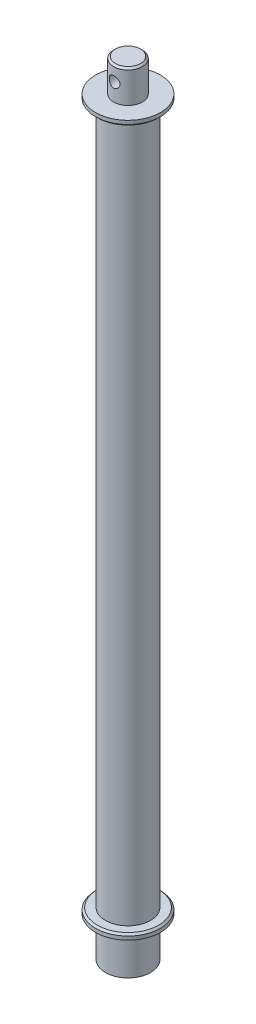
from build123d import *

# Parameters (mm, degrees)
SKETCH_1_R               = 7.95
EXTRUDE_1_DEPTH          = 18
CUT_EXTRUDE_2_DEPTH      = 22.22274723
CUT_EXTRUDE_2_DEPTH_BACK = 22.22274723
SKETCH_9_R               = 3
CHAMFER_2_SIZE           = 1
SKETCH_4_R               = 18
EXTRUDE_2_DEPTH          = 3
CHAMFER_1_SIZE           = 1
SKETCH_5_R               = 12.5
EXTRUDE_3_DEPTH          = 387.21
SKETCH_11_R              = 18
EXTRUDE_4_DEPTH          = 3
CHAMFER_3_SIZE           = 1
SKETCH_12_R              = 12.5
EXTRUDE_5_DEPTH          = 22


with BuildPart() as part:
    # 草图1 → 凸台-拉伸1 (new body)
    with BuildSketch(Plane(origin=(0, 0, 0), x_dir=(1, 0, 0), z_dir=(0, 1, 0))):
        with Locations(Location((0, 0, 0), (0, 0, 270))):
            Circle(SKETCH_1_R)
    extrude(amount=EXTRUDE_1_DEPTH)

    # 草图9 → 切除-拉伸2 (cut, two sides: drawn at the far end of the back side and taken through both)
    with BuildSketch(Plane.XY.offset(-CUT_EXTRUDE_2_DEPTH_BACK)):
        with Locations(Location((0, 9.7, 0), (0, 0, 89.999999999))):
            Circle(SKETCH_9_R)
    extrude(amount=CUT_EXTRUDE_2_DEPTH + CUT_EXTRUDE_2_DEPTH_BACK, mode=Mode.SUBTRACT)

    # 倒角2
    chamfer_2_edges = [part.edges().sort_by_distance(p)[0] for p in [
        (0, 18, -7.95),
    ]]
    chamfer(chamfer_2_edges, length=CHAMFER_2_SIZE)

    # 草图4 → 凸台-拉伸2 (add)
    with BuildSketch(Plane(origin=(0, 0, 0), x_dir=(1, 0, 0), z_dir=(0, 1, 0))):
        with Locations(Location((0, 0, 0), (0, 0, 270))):
            Circle(SKETCH_4_R)
    extrude(amount=-EXTRUDE_2_DEPTH)

    # 倒角1
    chamfer_1_edges = [part.edges().sort_by_distance(p)[0] for p in [
        (0, -3, -18),
    ]]
    chamfer(chamfer_1_edges, length=CHAMFER_1_SIZE)

    # 草图5 → 凸台-拉伸3 (add)
    with BuildSketch(Plane(origin=(0, -3, 0), x_dir=(-1, 0, 0), z_dir=(0, -1, 0))):
        with Locations(Location((0, 0, 0), (0, 0, 270))):
            Circle(SKETCH_5_R)
    extrude(amount=EXTRUDE_3_DEPTH)

    # 草图11 → 凸台-拉伸4 (add)
    with BuildSketch(Plane(origin=(0, -390.21, 0), x_dir=(-1, 0, 0), z_dir=(0, -1, 0))):
        with Locations(Location((0, 0, 0), (0, 0, 270))):
            Circle(SKETCH_11_R)
    extrude(amount=EXTRUDE_4_DEPTH)

    # 倒角3
    chamfer_3_edges = [part.edges().sort_by_distance(p)[0] for p in [
        (0, -390.21, -18),
    ]]
    chamfer(chamfer_3_edges, length=CHAMFER_3_SIZE)

    # 草图12 → 凸台-拉伸5 (add)
    with BuildSketch(Plane(origin=(0, -393.21, 0), x_dir=(-1, 0, 0), z_dir=(0, -1, 0))):
        with Locations(Location((0, 0, 0), (0, 0, 270))):
            Circle(SKETCH_12_R)
        with BuildLine():
            ThreePointArc((1.320081673, 7.281303755), (1.178664492, 7.305528729), (1.036804222, 7.32700737))
            add(Edge.make_bspline(
                [(1.036804222, 7.32700737), (0.98134965, 7.270157618), (0.925664274, 7.213171767), (0.822185541, 7.094937546), (0.774343886, 7.0337151), (0.63529092, 6.847559045), (0.548900941, 6.720025238), (0.477457544, 6.587144437)],
                knots=[0, 0, 0, 0, 0.25, 0.25, 0.5, 0.5, 1, 1, 1, 1], degree=3))
            add(Edge.make_bspline(
                [(0.477457544, 6.587144437), (0.46567048, 6.560002351), (0.446966493, 6.534634967), (0.392581446, 6.494187019), (0.35492303, 6.479375674), (0.274403836, 6.478342584), (0.234194599, 6.492926686), (0.17747799, 6.534562396), (0.158353176, 6.560913911), (0.146609232, 6.588640193)],
                knots=[0, 0, 0, 0, 0.25, 0.25, 0.5, 0.5, 0.75, 0.75, 1, 1, 1, 1], degree=3))
            add(Edge.make_bspline(
                [(0.146609232, 6.588640193), (0.08740641, 6.729534896), (0.022470705, 6.869008307), (-0.095794129, 7.071358543), (-0.138881023, 7.137641916), (-0.232486034, 7.266772188), (-0.282985736, 7.329709483), (-0.333258043, 7.392492075)],
                knots=[0, 0, 0, 0, 0.5, 0.5, 0.75, 0.75, 1, 1, 1, 1], degree=3))
            ThreePointArc((-0.333258043, 7.392492075), (-0.476520163, 7.384641395), (-0.619603147, 7.374014642))
            add(Edge.make_bspline(
                [(-0.619603147, 7.374014642), (-0.661016757, 7.306295373), (-0.702626317, 7.238396062), (-0.777131854, 7.100013493), (-0.81002747, 7.029653932), (-0.904545175, 6.817549796), (-0.96175064, 6.674495088), (-1.00180826, 6.529141787)],
                knots=[0, 0, 0, 0, 0.25, 0.25, 0.5, 0.5, 1, 1, 1, 1], degree=3))
            add(Edge.make_bspline(
                [(-1.00180826, 6.529141787), (-1.007260291, 6.500056407), (-1.019851277, 6.471161347), (-1.063877396, 6.419622784), (-1.097300476, 6.396802915), (-1.175575057, 6.377883569), (-1.218016451, 6.383157985), (-1.2825686, 6.411128867), (-1.307075953, 6.432562593), (-1.324694352, 6.456979366)],
                knots=[0, 0, 0, 0, 0.25, 0.25, 0.5, 0.5, 0.75, 0.75, 1, 1, 1, 1], degree=3))
            add(Edge.make_bspline(
                [(-1.324694352, 6.456979366), (-1.413614576, 6.580958145), (-1.507332752, 6.702515875), (-1.667328954, 6.873226276), (-1.724044414, 6.928139193), (-1.843879739, 7.033004611), (-1.907009883, 7.083047863), (-1.969886809, 7.132989974)],
                knots=[0, 0, 0, 0, 0.5, 0.5, 0.75, 0.75, 1, 1, 1, 1], degree=3))
            ThreePointArc((-1.969886809, 7.132989974), (-2.107810108, 7.093457306), (-2.244941028, 7.051258028))
            add(Edge.make_bspline(
                [(-2.244941028, 7.051258028), (-2.270240635, 6.97611209), (-2.29569085, 6.900747155), (-2.33740091, 6.749436272), (-2.353691734, 6.673613582), (-2.399065608, 6.44603228), (-2.42437654, 6.293898001), (-2.431078979, 6.143425776)],
                knots=[0, 0, 0, 0, 0.25, 0.25, 0.5, 0.5, 1, 1, 1, 1], degree=3))
            add(Edge.make_bspline(
                [(-2.431078979, 6.143425776), (-2.429922181, 6.113855694), (-2.43576799, 6.082881939), (-2.467225285, 6.0228357), (-2.494736028, 5.993149765), (-2.566842091, 5.957290187), (-2.609389834, 5.952991684), (-2.678542059, 5.965898104), (-2.70720286, 5.981340256), (-2.729811993, 6.001223703)],
                knots=[0, 0, 0, 0, 0.25, 0.25, 0.5, 0.5, 0.75, 0.75, 1, 1, 1, 1], degree=3))
            add(Edge.make_bspline(
                [(-2.729811993, 6.001223703), (-2.843877093, 6.102118361), (-2.961914778, 6.199724831), (-3.155568154, 6.330271891), (-3.22298186, 6.371086663), (-3.36290588, 6.446499746), (-3.435454942, 6.481176753), (-3.507737225, 6.51580997)],
                knots=[0, 0, 0, 0, 0.5, 0.5, 0.75, 0.75, 1, 1, 1, 1], degree=3))
            ThreePointArc((-3.507737225, 6.51580997), (-3.633405652, 6.446577648), (-3.757708191, 6.374921894))
            add(Edge.make_bspline(
                [(-3.757708191, 6.374921894), (-3.765661336, 6.296145746), (-3.773711675, 6.217123105), (-3.780628656, 6.060577536), (-3.779555087, 5.98316972), (-3.773567955, 5.751425564), (-3.76559783, 5.597330834), (-3.73868501, 5.449337815)],
                knots=[0, 0, 0, 0, 0.25, 0.25, 0.5, 0.5, 1, 1, 1, 1], degree=3))
            add(Edge.make_bspline(
                [(-3.73868501, 5.449337815), (-3.730977124, 5.420766049), (-3.729784019, 5.389267097), (-3.747092838, 5.323723878), (-3.767310283, 5.288659423), (-3.829632003, 5.237655307), (-3.870154864, 5.223999521), (-3.940441779, 5.221196026), (-3.971819075, 5.229873104), (-3.998285225, 5.244226695)],
                knots=[0, 0, 0, 0, 0.25, 0.25, 0.5, 0.5, 0.75, 0.75, 1, 1, 1, 1], degree=3))
            add(Edge.make_bspline(
                [(-3.998285225, 5.244226695), (-4.131679461, 5.317066829), (-4.268286418, 5.385729002), (-4.485811664, 5.469600321), (-4.560473941, 5.49433348), (-4.71337102, 5.536635681), (-4.791666926, 5.5542605), (-4.869695049, 5.571900047)],
                knots=[0, 0, 0, 0, 0.5, 0.5, 0.75, 0.75, 1, 1, 1, 1], degree=3))
            ThreePointArc((-4.869695049, 5.571900047), (-4.976807066, 5.476439668), (-5.082048175, 5.378920556))
            add(Edge.make_bspline(
                [(-5.082048175, 5.378920556), (-5.072307153, 5.300480381), (-5.062604808, 5.221779379), (-5.034518789, 5.067912661), (-5.016219275, 4.992847823), (-4.959223266, 4.768468173), (-4.918131698, 4.619753183), (-4.859057526, 4.481682374)],
                knots=[0, 0, 0, 0, 0.25, 0.25, 0.5, 0.5, 1, 1, 1, 1], degree=3))
            add(Edge.make_bspline(
                [(-4.859057526, 4.481682374), (-4.84518497, 4.455541927), (-4.837012485, 4.425097777), (-4.839303134, 4.35734495), (-4.85121199, 4.318660125), (-4.900623152, 4.255067306), (-4.937090851, 4.232738081), (-5.004990321, 4.214365565), (-5.037511241, 4.215842975), (-5.066507504, 4.223947336)],
                knots=[0, 0, 0, 0, 0.25, 0.25, 0.5, 0.5, 0.75, 0.75, 1, 1, 1, 1], degree=3))
            add(Edge.make_bspline(
                [(-5.066507504, 4.223947336), (-5.212479986, 4.265197318), (-5.360842681, 4.301259016), (-5.591236124, 4.334292187), (-5.669365778, 4.341792837), (-5.82752242, 4.349018187), (-5.907622431, 4.348769055), (-5.987466029, 4.348591789)],
                knots=[0, 0, 0, 0, 0.5, 0.5, 0.75, 0.75, 1, 1, 1, 1], degree=3))
            ThreePointArc((-5.987466029, 4.348591789), (-6.070650592, 4.231690135), (-6.151553043, 4.113197681))
            add(Edge.make_bspline(
                [(-6.151553043, 4.113197681), (-6.124665565, 4.039025234), (-6.097756483, 3.964591683), (-6.036232894, 3.821126102), (-6.001721667, 3.752176471), (-5.89662458, 3.54632475), (-5.824172681, 3.410224987), (-5.736016371, 3.288981736)],
                knots=[0, 0, 0, 0, 0.25, 0.25, 0.5, 0.5, 1, 1, 1, 1], degree=3))
            add(Edge.make_bspline(
                [(-5.736016371, 3.288981736), (-5.716674869, 3.266583661), (-5.701932862, 3.238721432), (-5.689089612, 3.172157886), (-5.692091568, 3.131793217), (-5.726112746, 3.058799878), (-5.756697383, 3.028915331), (-5.818806504, 2.995894044), (-5.850840964, 2.990097794), (-5.880913704, 2.99154669)],
                knots=[0, 0, 0, 0, 0.25, 0.25, 0.5, 0.5, 0.75, 0.75, 1, 1, 1, 1], degree=3))
            add(Edge.make_bspline(
                [(-5.880913704, 2.99154669), (-6.032125452, 2.999266228), (-6.184669857, 3.000659406), (-6.416269574, 2.981259188), (-6.493951949, 2.971250179), (-6.649452268, 2.943197824), (-6.727343, 2.925149799), (-6.805000462, 2.907226981)],
                knots=[0, 0, 0, 0, 0.5, 0.5, 0.75, 0.75, 1, 1, 1, 1], degree=3))
            ThreePointArc((-6.805000462, 2.907226981), (-6.860086348, 2.774745989), (-6.912593354, 2.641221899))
            add(Edge.make_bspline(
                [(-6.912593354, 2.641221899), (-6.86996668, 2.575015519), (-6.827259822, 2.508561801), (-6.735534222, 2.382638229), (-6.68663265, 2.323229472), (-6.538755144, 2.146143868), (-6.438293854, 2.029438921), (-6.325587168, 1.931042891)],
                knots=[0, 0, 0, 0, 0.25, 0.25, 0.5, 0.5, 1, 1, 1, 1], degree=3))
            add(Edge.make_bspline(
                [(-6.325587168, 1.931042891), (-6.301746827, 1.91351047), (-6.281174901, 1.889627675), (-6.253842013, 1.827592925), (-6.247786067, 1.787573767), (-6.264709489, 1.708840724), (-6.287877015, 1.67289766), (-6.341082224, 1.626881406), (-6.371024468, 1.614101802), (-6.400666098, 1.608822474)],
                knots=[0, 0, 0, 0, 0.25, 0.25, 0.5, 0.5, 0.75, 0.75, 1, 1, 1, 1], degree=3))
            add(Edge.make_bspline(
                [(-6.400666098, 1.608822474), (-6.549559075, 1.582743795), (-6.698324928, 1.549172857), (-6.919406346, 1.478394293), (-6.992789957, 1.451467308), (-7.137909138, 1.389684274), (-7.209706129, 1.354796727), (-7.281303755, 1.320081673)],
                knots=[0, 0, 0, 0, 0.5, 0.5, 0.75, 0.75, 1, 1, 1, 1], degree=3))
            ThreePointArc((-7.281303755, 1.320081673), (-7.305528729, 1.178664493), (-7.32700737, 1.036804223))
            add(Edge.make_bspline(
                [(-7.32700737, 1.036804223), (-7.270829339, 0.981845361), (-7.21451758, 0.926666067), (-7.097308167, 0.824494804), (-7.036536641, 0.777540611), (-6.853346185, 0.638018122), (-6.729723915, 0.546669005), (-6.598206373, 0.475958565)],
                knots=[0, 0, 0, 0, 0.25, 0.25, 0.5, 0.5, 1, 1, 1, 1], degree=3))
            add(Edge.make_bspline(
                [(-6.598206373, 0.475958565), (-6.571624678, 0.463639432), (-6.546877049, 0.444637459), (-6.507538993, 0.390166285), (-6.493277367, 0.35281192), (-6.492280063, 0.273518396), (-6.506240234, 0.233785027), (-6.546781435, 0.176863082), (-6.572509338, 0.157415149), (-6.59970213, 0.145110252)],
                knots=[0, 0, 0, 0, 0.25, 0.25, 0.5, 0.5, 0.75, 0.75, 1, 1, 1, 1], degree=3))
            add(Edge.make_bspline(
                [(-6.59970213, 0.145110252), (-6.738870057, 0.086632861), (-6.875941633, 0.019665553), (-7.075315702, -0.09884181), (-7.140797267, -0.141273025), (-7.268373925, -0.233592416), (-7.330511037, -0.283531059), (-7.392492075, -0.333258043)],
                knots=[0, 0, 0, 0, 0.5, 0.5, 0.75, 0.75, 1, 1, 1, 1], degree=3))
            ThreePointArc((-7.392492075, -0.333258043), (-7.384641395, -0.476520163), (-7.374014642, -0.619603147))
            add(Edge.make_bspline(
                [(-7.374014642, -0.619603147), (-7.307137234, -0.660609026), (-7.240080527, -0.701797019), (-7.103332751, -0.775228732), (-7.033771876, -0.807459702), (-6.824506903, -0.902506121), (-6.683886014, -0.96371013), (-6.540203723, -1.00330724)],
                knots=[0, 0, 0, 0, 0.25, 0.25, 0.5, 0.5, 1, 1, 1, 1], degree=3))
            add(Edge.make_bspline(
                [(-6.540203723, -1.00330724), (-6.511347255, -1.00910232), (-6.482739972, -1.021921218), (-6.431772235, -1.066116528), (-6.409274207, -1.099443431), (-6.390513761, -1.177071883), (-6.395515726, -1.219205986), (-6.422889996, -1.283735745), (-6.443966352, -1.308345255), (-6.468041302, -1.326193332)],
                knots=[0, 0, 0, 0, 0.25, 0.25, 0.5, 0.5, 0.75, 0.75, 1, 1, 1, 1], degree=3))
            add(Edge.make_bspline(
                [(-6.468041302, -1.326193332), (-6.590585732, -1.414084809), (-6.708551773, -1.511042288), (-6.876132514, -1.671225086), (-6.9305228, -1.727007263), (-7.034294678, -1.845195621), (-7.083694901, -1.907661656), (-7.132989974, -1.969886809)],
                knots=[0, 0, 0, 0, 0.5, 0.5, 0.75, 0.75, 1, 1, 1, 1], degree=3))
            ThreePointArc((-7.132989974, -1.969886809), (-7.093457306, -2.107810108), (-7.051258028, -2.244941028))
            add(Edge.make_bspline(
                [(-7.051258028, -2.244941028), (-6.977050627, -2.269992263), (-6.902628685, -2.295178253), (-6.753208404, -2.336331226), (-6.678338983, -2.352311874), (-6.453543439, -2.398199602), (-6.303121798, -2.425957395), (-6.154487712, -2.432577958)],
                knots=[0, 0, 0, 0, 0.25, 0.25, 0.5, 0.5, 1, 1, 1, 1], degree=3))
            add(Edge.make_bspline(
                [(-6.154487712, -2.432577958), (-6.124965795, -2.431542676), (-6.094067853, -2.437477983), (-6.034193537, -2.469017995), (-6.004615511, -2.49651281), (-5.968842443, -2.56841858), (-5.964471907, -2.610863097), (-5.977193326, -2.679979868), (-5.992521252, -2.70865298), (-6.012285639, -2.731310973)],
                knots=[0, 0, 0, 0, 0.25, 0.25, 0.5, 0.5, 0.75, 0.75, 1, 1, 1, 1], degree=3))
            add(Edge.make_bspline(
                [(-6.012285639, -2.731310973), (-6.112142188, -2.844202248), (-6.204549346, -2.966054877), (-6.331861183, -3.159767754), (-6.372526395, -3.226120105), (-6.4474172, -3.364273666), (-6.48163794, -3.436134768), (-6.51580997, -3.507737224)],
                knots=[0, 0, 0, 0, 0.5, 0.5, 0.75, 0.75, 1, 1, 1, 1], degree=3))
            ThreePointArc((-6.51580997, -3.507737224), (-6.446577648, -3.633405652), (-6.374921894, -3.757708191))
            add(Edge.make_bspline(
                [(-6.374921894, -3.757708191), (-6.297102394, -3.765598577), (-6.21904506, -3.773570126), (-6.064397237, -3.7805044), (-5.987928246, -3.779507791), (-5.758921713, -3.774016921), (-5.606565563, -3.76676453), (-5.460399751, -3.740183989)],
                knots=[0, 0, 0, 0, 0.25, 0.25, 0.5, 0.5, 1, 1, 1, 1], degree=3))
            add(Edge.make_bspline(
                [(-5.460399751, -3.740183989), (-5.431823439, -3.732418074), (-5.40030852, -3.731177545), (-5.334720481, -3.748415503), (-5.299616831, -3.768608497), (-5.248540205, -3.830981635), (-5.234880471, -3.871572018), (-5.232141539, -3.941927929), (-5.24087366, -3.973321938), (-5.255288632, -3.999784205)],
                knots=[0, 0, 0, 0, 0.25, 0.25, 0.5, 0.5, 0.75, 0.75, 1, 1, 1, 1], degree=3))
            add(Edge.make_bspline(
                [(-5.255288632, -3.999784205), (-5.327511438, -4.132047911), (-5.389270515, -4.272286497), (-5.469870449, -4.489707851), (-5.494845986, -4.563356811), (-5.537194431, -4.714621993), (-5.554541842, -4.792290433), (-5.571900047, -4.869695049)],
                knots=[0, 0, 0, 0, 0.5, 0.5, 0.75, 0.75, 1, 1, 1, 1], degree=3))
            ThreePointArc((-5.571900047, -4.869695049), (-5.476439668, -4.976807066), (-5.378920556, -5.082048175))
            add(Edge.make_bspline(
                [(-5.378920556, -5.082048175), (-5.301372786, -5.072419594), (-5.223576685, -5.062815367), (-5.071366047, -5.03526514), (-4.997058759, -5.017385834), (-4.775370132, -4.96086732), (-4.629176425, -4.918929555), (-4.49274431, -4.860556505)],
                knots=[0, 0, 0, 0, 0.25, 0.25, 0.5, 0.5, 1, 1, 1, 1], degree=3))
            add(Edge.make_bspline(
                [(-4.49274431, -4.860556505), (-4.46662118, -4.846540536), (-4.436157617, -4.838243813), (-4.368313369, -4.840349291), (-4.329535439, -4.852192893), (-4.265745411, -4.901715291), (-4.243394366, -4.938335211), (-4.225157199, -5.00641079), (-4.226757265, -5.038991519), (-4.235009272, -5.068006484)],
                knots=[0, 0, 0, 0, 0.25, 0.25, 0.5, 0.5, 0.75, 0.75, 1, 1, 1, 1], degree=3))
            add(Edge.make_bspline(
                [(-4.235009272, -5.068006484), (-4.276003088, -5.213071968), (-4.303709721, -5.364153748), (-4.333505381, -5.594282073), (-4.341580003, -5.671613239), (-4.349304529, -5.82851082), (-4.34891285, -5.908116317), (-4.348591789, -5.987466029)],
                knots=[0, 0, 0, 0, 0.5, 0.5, 0.75, 0.75, 1, 1, 1, 1], degree=3))
            ThreePointArc((-4.348591789, -5.987466029), (-4.231690135, -6.070650591), (-4.113197681, -6.151553043))
            add(Edge.make_bspline(
                [(-4.113197681, -6.151553043), (-4.039783559, -6.124908026), (-3.966123504, -6.098230328), (-3.823872387, -6.037603171), (-3.755367487, -6.003743254), (-3.552160679, -5.899099438), (-3.419978779, -5.824720505), (-3.300043672, -5.737515351)],
                knots=[0, 0, 0, 0, 0.25, 0.25, 0.5, 0.5, 1, 1, 1, 1], degree=3))
            add(Edge.make_bspline(
                [(-3.300043672, -5.737515351), (-3.277689094, -5.71805789), (-3.249837572, -5.703209451), (-3.183244497, -5.690191205), (-3.142821584, -5.693114769), (-3.069641507, -5.727178304), (-3.039697101, -5.757887731), (-3.006744703, -5.820180345), (-3.001039094, -5.852293203), (-3.002608626, -5.882412684)],
                knots=[0, 0, 0, 0, 0.25, 0.25, 0.5, 0.5, 0.75, 0.75, 1, 1, 1, 1], degree=3))
            add(Edge.make_bspline(
                [(-3.002608626, -5.882412684), (-3.010300366, -6.033077262), (-3.002439505, -6.186882044), (-2.979889363, -6.418088259), (-2.970658465, -6.495310423), (-2.943353058, -6.650084899), (-2.92522611, -6.727659924), (-2.907226981, -6.805000461)],
                knots=[0, 0, 0, 0, 0.5, 0.5, 0.75, 0.75, 1, 1, 1, 1], degree=3))
            ThreePointArc((-2.907226981, -6.805000461), (-2.774745989, -6.860086348), (-2.641221899, -6.912593354))
            add(Edge.make_bspline(
                [(-2.641221899, -6.912593354), (-2.575596368, -6.870268027), (-2.509739634, -6.827855556), (-2.384476826, -6.737158649), (-2.325130051, -6.688981028), (-2.150649193, -6.541521223), (-2.039600761, -6.438761828), (-1.942104828, -6.327086147)],
                knots=[0, 0, 0, 0, 0.25, 0.25, 0.5, 0.5, 1, 1, 1, 1], degree=3))
            add(Edge.make_bspline(
                [(-1.942104828, -6.327086147), (-1.924576727, -6.303251681), (-1.900704329, -6.282688722), (-1.83871447, -6.255358909), (-1.798727924, -6.249288233), (-1.720006887, -6.266163113), (-1.684018358, -6.289323559), (-1.637952408, -6.342555239), (-1.625165542, -6.37251332), (-1.61988441, -6.402165077)],
                knots=[0, 0, 0, 0, 0.25, 0.25, 0.5, 0.5, 0.75, 0.75, 1, 1, 1, 1], degree=3))
            add(Edge.make_bspline(
                [(-1.61988441, -6.402165077), (-1.593827277, -6.550935046), (-1.550844136, -6.699256637), (-1.477031366, -6.919865932), (-1.450918131, -6.993182562), (-1.389876038, -7.138164228), (-1.354889165, -7.20983428), (-1.320081673, -7.281303755)],
                knots=[0, 0, 0, 0, 0.5, 0.5, 0.75, 0.75, 1, 1, 1, 1], degree=3))
            ThreePointArc((-1.320081673, -7.281303755), (-1.178664493, -7.305528729), (-1.036804223, -7.32700737))
            add(Edge.make_bspline(
                [(-1.036804223, -7.32700737), (-0.982256494, -7.271122895), (-0.927503814, -7.21509805), (-0.825564244, -7.098956367), (-0.778328663, -7.038868824), (-0.641325169, -6.855985118), (-0.557241733, -6.730312994), (-0.487020501, -6.599705353)],
                knots=[0, 0, 0, 0, 0.25, 0.25, 0.5, 0.5, 1, 1, 1, 1], degree=3))
            add(Edge.make_bspline(
                [(-0.487020501, -6.599705353), (-0.475080621, -6.572732965), (-0.456296872, -6.547556103), (-0.40192786, -6.507444512), (-0.364389199, -6.492787345), (-0.28425499, -6.491722616), (-0.244139505, -6.506109386), (-0.187317374, -6.547434913), (-0.168084032, -6.573620987), (-0.156172188, -6.601201109)],
                knots=[0, 0, 0, 0, 0.25, 0.25, 0.5, 0.5, 0.75, 0.75, 1, 1, 1, 1], degree=3))
            add(Edge.make_bspline(
                [(-0.156172188, -6.601201109), (-0.097577071, -6.740649557), (-0.021812834, -6.875679488), (0.099610678, -7.074555161), (0.141367622, -7.140338523), (0.233204146, -7.268305364), (0.283342296, -7.330476435), (0.333258043, -7.392492075)],
                knots=[0, 0, 0, 0, 0.5, 0.5, 0.75, 0.75, 1, 1, 1, 1], degree=3))
            ThreePointArc((0.333258043, -7.392492075), (0.476520163, -7.384641395), (0.619603147, -7.374014642))
            add(Edge.make_bspline(
                [(0.619603147, -7.374014642), (0.660370815, -7.307311833), (0.70130806, -7.240430228), (0.775084866, -7.104238162), (0.807926708, -7.035045768), (0.90038307, -6.826095977), (0.952825914, -6.684740119), (0.992245304, -6.541702703)],
                knots=[0, 0, 0, 0, 0.25, 0.25, 0.5, 0.5, 1, 1, 1, 1], degree=3))
            add(Edge.make_bspline(
                [(0.992245304, -6.541702703), (0.997695812, -6.512625446), (1.010280614, -6.483744594), (1.054262508, -6.4322312), (1.087645051, -6.409412425), (1.165883134, -6.390449487), (1.208367326, -6.395694154), (1.272983501, -6.42366762), (1.297506148, -6.445114017), (1.315131395, -6.469540282)],
                knots=[0, 0, 0, 0, 0.25, 0.25, 0.5, 0.5, 0.75, 0.75, 1, 1, 1, 1], degree=3))
            add(Edge.make_bspline(
                [(1.315131395, -6.469540282), (1.403440776, -6.59266738), (1.507935266, -6.70743162), (1.670932876, -6.874532702), (1.726326574, -6.929495134), (1.844490868, -7.034020791), (1.907315988, -7.083555964), (1.969886809, -7.132989973)],
                knots=[0, 0, 0, 0, 0.5, 0.5, 0.75, 0.75, 1, 1, 1, 1], degree=3))
            ThreePointArc((1.969886809, -7.132989973), (2.107810108, -7.093457306), (2.244941028, -7.051258028))
            add(Edge.make_bspline(
                [(2.244941028, -7.051258028), (2.269850953, -6.97706445), (2.294886899, -6.902658683), (2.336639301, -6.753282033), (2.353386826, -6.67842288), (2.396638684, -6.453899015), (2.414906713, -6.304368104), (2.421516022, -6.155986692)],
                knots=[0, 0, 0, 0, 0.25, 0.25, 0.5, 0.5, 1, 1, 1, 1], degree=3))
            add(Edge.make_bspline(
                [(2.421516022, -6.155986692), (2.420359754, -6.126430154), (2.42606912, -6.095760585), (2.457666063, -6.035331432), (2.485143191, -6.005707166), (2.557440534, -5.969789244), (2.599530867, -5.965522609), (2.669026949, -5.978442784), (2.697639291, -5.993900633), (2.720249036, -6.013784618)],
                knots=[0, 0, 0, 0, 0.25, 0.25, 0.5, 0.5, 0.75, 0.75, 1, 1, 1, 1], degree=3))
            add(Edge.make_bspline(
                [(2.720249036, -6.013784618), (2.833958276, -6.114364687), (2.961706079, -6.203082965), (3.15816033, -6.32996766), (3.224498155, -6.371323427), (3.363196322, -6.447096548), (3.435603284, -6.481473532), (3.507737224, -6.51580997)],
                knots=[0, 0, 0, 0, 0.5, 0.5, 0.75, 0.75, 1, 1, 1, 1], degree=3))
            ThreePointArc((3.507737224, -6.51580997), (3.633405652, -6.446577647), (3.757708191, -6.374921894))
            add(Edge.make_bspline(
                [(3.757708191, -6.374921894), (3.765474723, -6.296929182), (3.773317866, -6.218701023), (3.780860722, -6.06352427), (3.780615646, -5.986675002), (3.772409596, -5.757927451), (3.755734546, -5.608240252), (3.729122053, -5.461898731)],
                knots=[0, 0, 0, 0, 0.25, 0.25, 0.5, 0.5, 1, 1, 1, 1], degree=3))
            add(Edge.make_bspline(
                [(3.729122053, -5.461898731), (3.721416487, -5.433335563), (3.720234329, -5.401798135), (3.737502503, -5.336368126), (3.757655938, -5.301330536), (3.819971289, -5.25026093), (3.860512934, -5.236574856), (3.930842792, -5.233747128), (3.962245647, -5.24242834), (3.988722268, -5.256787611)],
                knots=[0, 0, 0, 0, 0.25, 0.25, 0.5, 0.5, 0.75, 0.75, 1, 1, 1, 1], degree=3))
            add(Edge.make_bspline(
                [(3.988722268, -5.256787611), (4.122223543, -5.329686193), (4.266671225, -5.388035486), (4.486793268, -5.468284149), (4.560814599, -5.493894215), (4.713190584, -5.536993747), (4.791581441, -5.554435329), (4.869695049, -5.571900047)],
                knots=[0, 0, 0, 0, 0.5, 0.5, 0.75, 0.75, 1, 1, 1, 1], degree=3))
            ThreePointArc((4.869695049, -5.571900047), (4.976807066, -5.476439667), (5.082048175, -5.378920556))
            add(Edge.make_bspline(
                [(5.082048175, -5.378920556), (5.072230202, -5.301023499), (5.062435761, -5.222878746), (5.03525604, -5.069618206), (5.017944366, -4.99458565), (4.958615656, -4.773190077), (4.908104482, -4.631229012), (4.849494569, -4.494243289)],
                knots=[0, 0, 0, 0, 0.25, 0.25, 0.5, 0.5, 1, 1, 1, 1], degree=3))
            add(Edge.make_bspline(
                [(4.849494569, -4.494243289), (4.835616179, -4.468091848), (4.827427908, -4.437775543), (4.829768153, -4.369602472), (4.841358937, -4.331530263), (4.891563584, -4.267044762), (4.927578899, -4.245279052), (4.995435029, -4.226930556), (5.027959783, -4.228407104), (5.056944547, -4.236508251)],
                knots=[0, 0, 0, 0, 0.25, 0.25, 0.5, 0.5, 0.75, 0.75, 1, 1, 1, 1], degree=3))
            add(Edge.make_bspline(
                [(5.056944547, -4.236508251), (5.203602863, -4.277952183), (5.357503844, -4.303228143), (5.590327447, -4.332763287), (5.668353865, -4.341254566), (5.826814133, -4.349365459), (5.907273349, -4.34893547), (5.987466029, -4.348591789)],
                knots=[0, 0, 0, 0, 0.5, 0.5, 0.75, 0.75, 1, 1, 1, 1], degree=3))
            ThreePointArc((5.987466029, -4.348591789), (6.070650591, -4.231690135), (6.151553043, -4.113197681))
            add(Edge.make_bspline(
                [(6.151553043, -4.113197681), (6.124583133, -4.039304216), (6.09758228, -3.965162295), (6.036886712, -3.821494047), (6.003278493, -3.752033399), (5.895740814, -3.549204004), (5.814243398, -3.422282087), (5.726453415, -3.301542651)],
                knots=[0, 0, 0, 0, 0.25, 0.25, 0.5, 0.5, 1, 1, 1, 1], degree=3))
            add(Edge.make_bspline(
                [(5.726453415, -3.301542651), (5.70711549, -3.279148719), (5.692380095, -3.251285781), (5.679535313, -3.184812978), (5.682557947, -3.144179132), (5.716699765, -3.071151665), (5.746867425, -3.041630156), (5.809415924, -3.008351378), (5.841300643, -3.0026598), (5.871350747, -3.004107606)],
                knots=[0, 0, 0, 0, 0.25, 0.25, 0.5, 0.5, 0.75, 0.75, 1, 1, 1, 1], degree=3))
            add(Edge.make_bspline(
                [(5.871350747, -3.004107606), (6.023828681, -3.011891921), (6.179631422, -3.003072451), (6.413565407, -2.980358974), (6.491678393, -2.971209579), (6.648263692, -2.94376439), (6.726752761, -2.925423003), (6.805000461, -2.907226981)],
                knots=[0, 0, 0, 0, 0.5, 0.5, 0.75, 0.75, 1, 1, 1, 1], degree=3))
            ThreePointArc((6.805000461, -2.907226981), (6.860086348, -2.774745989), (6.912593354, -2.641221899))
            add(Edge.make_bspline(
                [(6.912593354, -2.641221899), (6.86976468, -2.575058863), (6.826851514, -2.508658174), (6.735532407, -2.381837093), (6.687221533, -2.321464741), (6.536822945, -2.147482722), (6.42870485, -2.041977096), (6.316024211, -1.943603807)],
                knots=[0, 0, 0, 0, 0.25, 0.25, 0.5, 0.5, 1, 1, 1, 1], degree=3))
            add(Edge.make_bspline(
                [(6.316024211, -1.943603807), (6.292202798, -1.926085306), (6.271651915, -1.902231085), (6.244322401, -1.840300294), (6.238219617, -1.80007818), (6.25517879, -1.721324441), (6.278134546, -1.685622461), (6.331648585, -1.639321858), (6.36147363, -1.626660559), (6.391103141, -1.621383389)],
                knots=[0, 0, 0, 0, 0.25, 0.25, 0.5, 0.5, 0.75, 0.75, 1, 1, 1, 1], degree=3))
            add(Edge.make_bspline(
                [(6.391103141, -1.621383389), (6.541729214, -1.595001158), (6.69194757, -1.552723515), (6.915357219, -1.478839564), (6.989595583, -1.452422514), (7.136382962, -1.390656815), (7.208944937, -1.355270783), (7.281303755, -1.320081673)],
                knots=[0, 0, 0, 0, 0.5, 0.5, 0.75, 0.75, 1, 1, 1, 1], degree=3))
            ThreePointArc((7.281303755, -1.320081673), (7.305528729, -1.178664493), (7.32700737, -1.036804222))
            add(Edge.make_bspline(
                [(7.32700737, -1.036804222), (7.270516282, -0.981524202), (7.21384699, -0.926100448), (7.096137231, -0.823440055), (7.035290397, -0.775846781), (6.912053503, -0.683229244), (6.849785584, -0.638082087), (6.721178434, -0.557651364), (6.655248604, -0.522126639), (6.588643417, -0.488519481)],
                knots=[0, 0, 0, 0, 0.25, 0.25, 0.5, 0.5, 0.75, 0.75, 1, 1, 1, 1], degree=3))
            add(Edge.make_bspline(
                [(6.588643417, -0.488519481), (6.561514446, -0.476738112), (6.536164364, -0.45804855), (6.49573421, -0.403728944), (6.48088063, -0.36632396), (6.479835772, -0.285141211), (6.494187284, -0.245600895), (6.536230184, -0.188290374), (6.56242334, -0.169410687), (6.590139173, -0.157671168)],
                knots=[0, 0, 0, 0, 0.25, 0.25, 0.5, 0.5, 0.75, 0.75, 1, 1, 1, 1], degree=3))
            add(Edge.make_bspline(
                [(6.590139173, -0.157671168), (6.731618184, -0.099892576), (6.869008547, -0.025561734), (7.070502771, 0.096970963), (7.137119201, 0.13919962), (7.266757098, 0.231958076), (7.329709777, 0.282708602), (7.392492075, 0.333258043)],
                knots=[0, 0, 0, 0, 0.5, 0.5, 0.75, 0.75, 1, 1, 1, 1], degree=3))
            ThreePointArc((7.392492075, 0.333258043), (7.384641395, 0.476520163), (7.374014642, 0.619603147))
            add(Edge.make_bspline(
                [(7.374014642, 0.619603147), (7.306468657, 0.660973003), (7.238741537, 0.702534707), (7.100647139, 0.776668242), (7.030396293, 0.809267586), (6.818939408, 0.904598163), (6.676384081, 0.963426857), (6.530640767, 0.990746324)],
                knots=[0, 0, 0, 0, 0.25, 0.25, 0.5, 0.5, 1, 1, 1, 1], degree=3))
            add(Edge.make_bspline(
                [(6.530640767, 0.990746324), (6.501535921, 0.996202004), (6.472626587, 1.00880555), (6.421078037, 1.052865444), (6.39825721, 1.086312078), (6.379372331, 1.164667049), (6.384468217, 1.206461111), (6.412724379, 1.27178706), (6.434058855, 1.296012056), (6.458478345, 1.313632416)],
                knots=[0, 0, 0, 0, 0.25, 0.25, 0.5, 0.5, 0.75, 0.75, 1, 1, 1, 1], degree=3))
            add(Edge.make_bspline(
                [(6.458478345, 1.313632416), (6.583020117, 1.40295643), (6.701516531, 1.504128765), (6.871668457, 1.667094161), (6.927135264, 1.723414573), (7.032747431, 1.843193706), (7.082917283, 1.906673569), (7.132989973, 1.969886809)],
                knots=[0, 0, 0, 0, 0.5, 0.5, 0.75, 0.75, 1, 1, 1, 1], degree=3))
            ThreePointArc((7.132989973, 1.969886809), (7.093457306, 2.107810108), (7.051258028, 2.244941028))
            add(Edge.make_bspline(
                [(7.051258028, 2.244941028), (6.97612348, 2.270098673), (6.900772378, 2.29539767), (6.749499885, 2.337738569), (6.67368407, 2.354788174), (6.446404297, 2.397255153), (6.295181008, 2.413324223), (6.144924755, 2.420017043)],
                knots=[0, 0, 0, 0, 0.25, 0.25, 0.5, 0.5, 1, 1, 1, 1], degree=3))
            add(Edge.make_bspline(
                [(6.144924755, 2.420017043), (6.115353347, 2.418860193), (6.084383669, 2.42470716), (6.02435316, 2.45615112), (5.994671316, 2.483644944), (5.958795374, 2.555751448), (5.954486422, 2.598308902), (5.967402609, 2.667505999), (5.982835709, 2.696136913), (6.002722682, 2.718750057)],
                knots=[0, 0, 0, 0, 0.25, 0.25, 0.5, 0.5, 0.75, 0.75, 1, 1, 1, 1], degree=3))
            add(Edge.make_bspline(
                [(6.002722682, 2.718750057), (6.104321516, 2.833611046), (6.19832592, 2.957582623), (6.328409079, 3.154026669), (6.369904802, 3.221408161), (6.446190692, 3.361852276), (6.481018111, 3.434935332), (6.51580997, 3.507737224)],
                knots=[0, 0, 0, 0, 0.5, 0.5, 0.75, 0.75, 1, 1, 1, 1], degree=3))
            ThreePointArc((6.51580997, 3.507737224), (6.446577647, 3.633405652), (6.374921894, 3.757708191))
            add(Edge.make_bspline(
                [(6.374921894, 3.757708191), (6.295972158, 3.765535964), (6.216778543, 3.773455768), (6.059694966, 3.781012338), (5.981908222, 3.780679226), (5.750513805, 3.771707425), (5.599018386, 3.754570186), (5.450836795, 3.727623073)],
                knots=[0, 0, 0, 0, 0.25, 0.25, 0.5, 0.5, 1, 1, 1, 1], degree=3))
            add(Edge.make_bspline(
                [(5.450836795, 3.727623073), (5.42226972, 3.719916453), (5.39078149, 3.718724219), (5.325269072, 3.736012497), (5.290217988, 3.756203502), (5.239194926, 3.818492501), (5.225503193, 3.858932101), (5.222689615, 3.929558189), (5.231367665, 3.960748993), (5.245725675, 3.987223289)],
                knots=[0, 0, 0, 0, 0.25, 0.25, 0.5, 0.5, 0.75, 0.75, 1, 1, 1, 1], degree=3))
            add(Edge.make_bspline(
                [(5.245725675, 3.987223289), (5.319227865, 4.121829968), (5.384454861, 4.262762424), (5.468028642, 4.482955262), (5.493400134, 4.557968839), (5.536438913, 4.711961859), (5.554155881, 4.790969055), (5.571900047, 4.869695049)],
                knots=[0, 0, 0, 0, 0.5, 0.5, 0.75, 0.75, 1, 1, 1, 1], degree=3))
            ThreePointArc((5.571900047, 4.869695049), (5.476439667, 4.976807066), (5.378920556, 5.082048175))
            add(Edge.make_bspline(
                [(5.378920556, 5.082048175), (5.300132951, 5.072116586), (5.22108549, 5.0622223), (5.06615884, 5.034531593), (4.990375087, 5.016789562), (4.766411501, 4.956777557), (4.621793654, 4.907301441), (4.483181353, 4.84799559)],
                knots=[0, 0, 0, 0, 0.25, 0.25, 0.5, 0.5, 1, 1, 1, 1], degree=3))
            add(Edge.make_bspline(
                [(4.483181353, 4.84799559), (4.45706623, 4.834136473), (4.42666048, 4.825969411), (4.359003124, 4.828214868), (4.320370277, 4.840061994), (4.256778247, 4.889321007), (4.234369448, 4.925753844), (4.215881496, 4.993653272), (4.217336372, 5.026429332), (4.225446315, 5.055445568)],
                knots=[0, 0, 0, 0, 0.25, 0.25, 0.5, 0.5, 0.75, 0.75, 1, 1, 1, 1], degree=3))
            add(Edge.make_bspline(
                [(4.225446315, 5.055445568), (4.267140483, 5.202989399), (4.300618625, 5.354293147), (4.333553351, 5.587316853), (4.341486789, 5.666126358), (4.349076939, 5.825839963), (4.348790503, 5.906786554), (4.348591789, 5.987466029)],
                knots=[0, 0, 0, 0, 0.5, 0.5, 0.75, 0.75, 1, 1, 1, 1], degree=3))
            ThreePointArc((4.348591789, 5.987466029), (4.231690135, 6.070650591), (4.113197681, 6.151553043))
            add(Edge.make_bspline(
                [(4.113197681, 6.151553043), (4.038549304, 6.124340884), (3.963637642, 6.097108475), (3.818748997, 6.035532034), (3.748852826, 6.001266617), (3.543478441, 5.89316687), (3.412498514, 5.81367392), (3.290480715, 5.724954435)],
                knots=[0, 0, 0, 0, 0.25, 0.25, 0.5, 0.5, 1, 1, 1, 1], degree=3))
            add(Edge.make_bspline(
                [(3.290480715, 5.724954435), (3.268086187, 5.705615996), (3.240231877, 5.690878194), (3.17369717, 5.6780304), (3.133350795, 5.681018279), (3.060357418, 5.715007581), (3.030443298, 5.745594641), (2.99739495, 5.807727242), (2.991596458, 5.83977248), (2.99304567, 5.869851768)],
                knots=[0, 0, 0, 0, 0.25, 0.25, 0.5, 0.5, 0.75, 0.75, 1, 1, 1, 1], degree=3))
            add(Edge.make_bspline(
                [(2.99304567, 5.869851768), (3.000857332, 6.022865371), (3.001047923, 6.177466621), (2.981732435, 6.411751372), (2.971826862, 6.490321319), (2.943605745, 6.647633442), (2.925344907, 6.726436986), (2.907226981, 6.805000461)],
                knots=[0, 0, 0, 0, 0.5, 0.5, 0.75, 0.75, 1, 1, 1, 1], degree=3))
            ThreePointArc((2.907226981, 6.805000461), (2.774745989, 6.860086348), (2.641221899, 6.912593354))
            add(Edge.make_bspline(
                [(2.641221899, 6.912593354), (2.574481741, 6.869465326), (2.50748801, 6.826259583), (2.380009301, 6.73391874), (2.31958338, 6.68488365), (2.143015656, 6.534048344), (2.031780288, 6.428196822), (1.932541871, 6.314525231)],
                knots=[0, 0, 0, 0, 0.25, 0.25, 0.5, 0.5, 1, 1, 1, 1], degree=3))
            add(Edge.make_bspline(
                [(1.932541871, 6.314525231), (1.915011308, 6.290687418), (1.891133092, 6.270119453), (1.829117947, 6.242787901), (1.789112839, 6.236725426), (1.71038429, 6.253628066), (1.674421506, 6.276792877), (1.628384194, 6.330009338), (1.615601548, 6.359958227), (1.610321453, 6.389604161)],
                knots=[0, 0, 0, 0, 0.25, 0.25, 0.5, 0.5, 0.75, 0.75, 1, 1, 1, 1], degree=3))
            add(Edge.make_bspline(
                [(1.610321453, 6.389604161), (1.583917407, 6.540354789), (1.550790442, 6.690979575), (1.480219433, 6.914873993), (1.453007242, 6.9891893), (1.390466234, 7.136118811), (1.355178878, 7.208812208), (1.320081673, 7.281303755)],
                knots=[0, 0, 0, 0, 0.5, 0.5, 0.75, 0.75, 1, 1, 1, 1], degree=3))
        make_face(mode=Mode.SUBTRACT)
    extrude(amount=EXTRUDE_5_DEPTH)


solid = part.part
